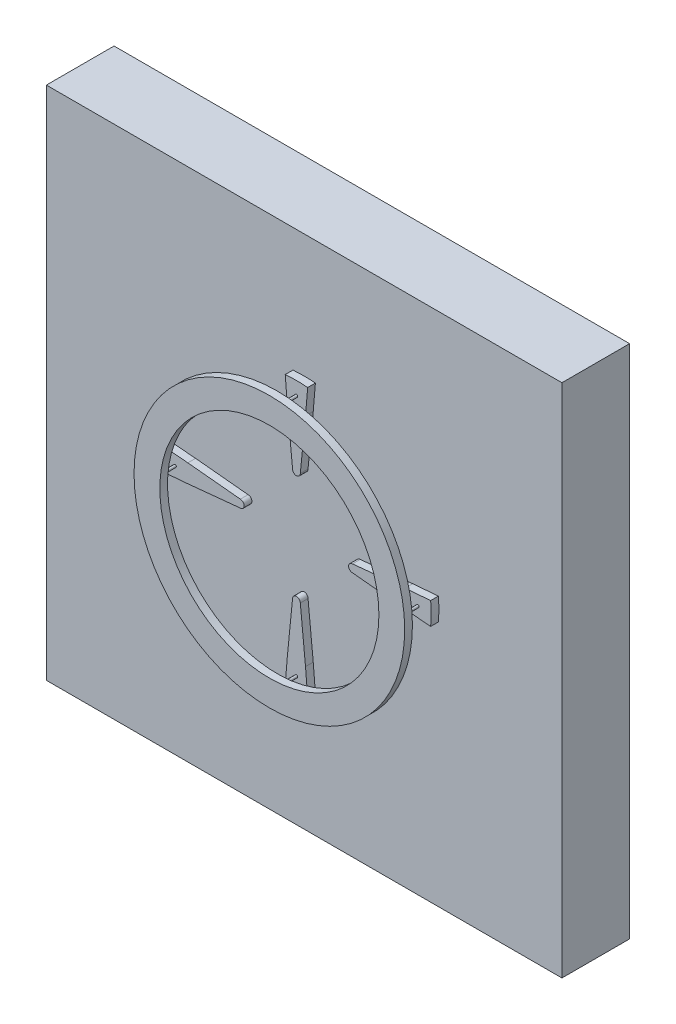
from build123d import *

# Parameters (mm, degrees)
EXTRUDE_1_DEPTH   = 0.06
EXTRUDE_1_2_DEPTH = 0.06
EXTRUDE_1_3_DEPTH = 0.06
EXTRUDE_1_4_DEPTH = 0.06
SKETCH_2_R        = 0.01
EXTRUDE_2_DEPTH   = 0.15
SKETCH_3_R        = 1.05
SKETCH_3_R_2      = 0.85
EXTRUDE_3_DEPTH   = 0.06
SKETCH_4_W        = 4
SKETCH_4_H        = 4
EXTRUDE_5_DEPTH   = 0.525


with BuildPart() as part:
    # 草圖1 → 填料-伸長1 (new body)
    with BuildSketch(Plane.XY):
        with BuildLine():
            Line((-0.03, 0.435), (-0.070388149, 0.842515581))
            Line((-0.070388149, 0.842515581), (-0.087001654, 1.041372033))
            ThreePointArc((-0.087001654, 1.041372033), (0, 1.045), (0.087001654, 1.041372033))
            Line((0.087001654, 1.041372033), (0.070388149, 0.842515581))
            Line((0.070388149, 0.842515581), (0.03, 0.435))
            ThreePointArc((0.03, 0.435), (0, 0.405), (-0.03, 0.435))
        make_face()
    extrude(amount=EXTRUDE_1_DEPTH)



with BuildPart() as body_2:
    # 草圖1 → Extrude 1 2 (new body)
    with BuildSketch(Plane.XY):
        with BuildLine():
            Line((0.435, 0.03), (0.842515581, 0.070388149))
            Line((0.842515581, 0.070388149), (1.041372033, 0.087001654))
            ThreePointArc((1.041372033, 0.087001654), (1.045, 0), (1.041372033, -0.087001654))
            Line((1.041372033, -0.087001654), (0.842515581, -0.070388149))
            Line((0.842515581, -0.070388149), (0.435, -0.03))
            ThreePointArc((0.435, -0.03), (0.405, 0), (0.435, 0.03))
        make_face()
    extrude(amount=EXTRUDE_1_2_DEPTH)


with BuildPart() as body_3:
    # 草圖1 → Extrude 1 3 (new body)
    with BuildSketch(Plane.XY):
        with BuildLine():
            Line((0.03, -0.435), (0.070388149, -0.842515581))
            Line((0.070388149, -0.842515581), (0.087001654, -1.041372033))
            ThreePointArc((0.087001654, -1.041372033), (0, -1.045), (-0.087001654, -1.041372033))
            Line((-0.087001654, -1.041372033), (-0.070388149, -0.842515581))
            Line((-0.070388149, -0.842515581), (-0.03, -0.435))
            ThreePointArc((-0.03, -0.435), (0, -0.405), (0.03, -0.435))
        make_face()
    extrude(amount=EXTRUDE_1_3_DEPTH)


with BuildPart() as body_4:
    # 草圖1 → Extrude 1 4 (new body)
    with BuildSketch(Plane.XY):
        with BuildLine():
            Line((-0.435, -0.03), (-0.842515581, -0.070388149))
            Line((-0.842515581, -0.070388149), (-1.041372033, -0.087001654))
            ThreePointArc((-1.041372033, -0.087001654), (-1.045, 0), (-1.041372033, 0.087001654))
            Line((-1.041372033, 0.087001654), (-0.842515581, 0.070388149))
            Line((-0.842515581, 0.070388149), (-0.435, 0.03))
            ThreePointArc((-0.435, 0.03), (-0.405, 0), (-0.435, -0.03))
        make_face()
    extrude(amount=EXTRUDE_1_4_DEPTH)


with BuildPart() as part_1:
    add(part.part)

    add(body_2.part)  # 填料-伸長2 merges body 2

    add(body_3.part)  # 填料-伸長2 merges body 3

    add(body_4.part)  # 填料-伸長2 merges body 4
    # 草圖2 → 填料-伸長2 (add)
    with BuildSketch(Plane.XY.offset(0.06)):
        with Locations((0.941943807, 0)):
            Circle(SKETCH_2_R)
        with Locations((0, 0.941943807)):
            Circle(SKETCH_2_R)
        with Locations((-0.941943807, 0)):
            Circle(SKETCH_2_R)
        with Locations((0, -0.941943807)):
            Circle(SKETCH_2_R)
    extrude(amount=EXTRUDE_2_DEPTH)

    # 草圖3 → 填料-伸長3 (add)
    with BuildSketch(Plane.XY.offset(0.21)):
        Circle(SKETCH_3_R)
        Circle(SKETCH_3_R_2, mode=Mode.SUBTRACT)
    extrude(amount=EXTRUDE_3_DEPTH)

    # 草圖4 → 填料-伸長5 (add)
    with BuildSketch(Plane(origin=(0, 0, 0), x_dir=(-1, 0, 0), z_dir=(0, 0, -1))):
        Rectangle(SKETCH_4_W, SKETCH_4_H)
    extrude(amount=EXTRUDE_5_DEPTH)


solid = part_1.part
